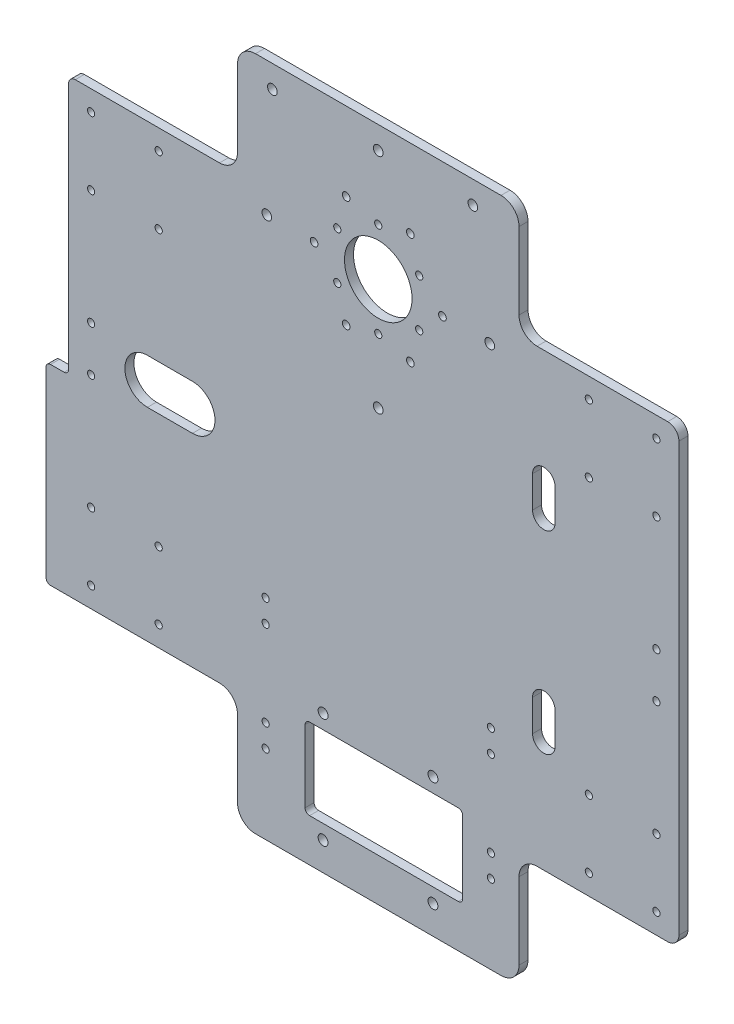
from build123d import *

# Parameters (mm, degrees)
SKETCH_281X300_25_R   = 1.6
SKETCH_281X300_25_R_2 = 15
SKETCH_281X300_25_R_3 = 2.15
SKETCH_281X300_25_R_4 = 2.2
F_4MM_DEPTH           = 4
XRU2012_3_4_57_2_R    = 1.7
XRU2012_3_4_57_DEPTH  = 4


with BuildPart() as part:
    # 底板轮廓_281x300_安装孔外移25 → 凸台拉伸_4mm (new body)
    with BuildSketch(Plane.XY):
        with BuildLine():
            Line((-55.5, 108), (-55.5, 142))
            ThreePointArc((-55.5, 142), (-53.156854249, 147.656854249), (-47.5, 150))
            Line((-47.5, 150), (61.5, 150))
            ThreePointArc((61.5, 150), (67.156854249, 147.656854249), (69.5, 142))
            Line((69.5, 142), (69.5, 108))
            ThreePointArc((69.5, 108), (71.843145751, 102.343145751), (77.5, 100))
            Line((77.5, 100), (135.5, 100))
            ThreePointArc((135.5, 100), (139.035533906, 98.535533906), (140.5, 95))
            Line((140.5, 95), (140.5, -95))
            ThreePointArc((140.5, -95), (139.035533906, -98.535533906), (135.5, -100))
            Line((135.5, -100), (77.5, -100))
            ThreePointArc((77.5, -100), (71.843145751, -102.343145751), (69.5, -108))
            Line((69.5, -108), (69.5, -142))
            ThreePointArc((69.5, -142), (67.156854249, -147.656854249), (61.5, -150))
            Line((61.5, -150), (-47.5, -150))
            ThreePointArc((-47.5, -150), (-53.156854249, -147.656854249), (-55.5, -142))
            Line((-55.5, -142), (-55.5, -108))
            ThreePointArc((-55.5, -108), (-57.843145751, -102.343145751), (-63.5, -100))
            Line((-63.5, -100), (-138.5, -100))
            ThreePointArc((-138.5, -100), (-139.914213562, -99.414213562), (-140.5, -98))
            Line((-140.5, -98), (-140.5, -17))
            ThreePointArc((-140.5, -17), (-139.914213562, -15.585786438), (-138.5, -15))
            Line((-138.5, -15), (-132.5, -15))
            ThreePointArc((-132.5, -15), (-131.085786438, -14.414213562), (-130.5, -13))
            Line((-130.5, -13), (-130.5, 97))
            ThreePointArc((-130.5, 97), (-129.621320344, 99.121320344), (-127.5, 100))
            Line((-127.5, 100), (-63.5, 100))
            ThreePointArc((-63.5, 100), (-57.843145751, 102.343145751), (-55.5, 108))
        make_face()
        with Locations((100.5, -61)):
            Circle(SKETCH_281X300_25_R, mode=Mode.SUBTRACT)
        with Locations((130.5, -61)):
            Circle(SKETCH_281X300_25_R, mode=Mode.SUBTRACT)
        with Locations((100.5, 61)):
            Circle(SKETCH_281X300_25_R, mode=Mode.SUBTRACT)
        with Locations((7, 90.5)):
            Circle(SKETCH_281X300_25_R_2, mode=Mode.SUBTRACT)
        with Locations((7, 140)):
            Circle(SKETCH_281X300_25_R_3, mode=Mode.SUBTRACT)
        with Locations((-42.5, 90.5)):
            Circle(SKETCH_281X300_25_R_3, mode=Mode.SUBTRACT)
        with Locations((56.5, 90.5)):
            Circle(SKETCH_281X300_25_R_3, mode=Mode.SUBTRACT)
        with Locations((-40, 140)):
            Circle(SKETCH_281X300_25_R_3, mode=Mode.SUBTRACT)
        with Locations((130.5, 61)):
            Circle(SKETCH_281X300_25_R, mode=Mode.SUBTRACT)
        with Locations((49, 140)):
            Circle(SKETCH_281X300_25_R_3, mode=Mode.SUBTRACT)
        with Locations((7, 41)):
            Circle(SKETCH_281X300_25_R_3, mode=Mode.SUBTRACT)
        with Locations((31.290367902, -137.395183951)):
            Circle(SKETCH_281X300_25_R_4, mode=Mode.SUBTRACT)
        with Locations((-17.5, -137.395183951)):
            Circle(SKETCH_281X300_25_R_4, mode=Mode.SUBTRACT)
        with Locations((-17.5, -88.604816049)):
            Circle(SKETCH_281X300_25_R_4, mode=Mode.SUBTRACT)
        with Locations((31.290367902, -88.604816049)):
            Circle(SKETCH_281X300_25_R_4, mode=Mode.SUBTRACT)
        with Locations((7, 111.5)):
            Circle(SKETCH_281X300_25_R, mode=Mode.SUBTRACT)
        with Locations((25.186533479, 101)):
            Circle(SKETCH_281X300_25_R, mode=Mode.SUBTRACT)
        with Locations((100.5, -91)):
            Circle(SKETCH_281X300_25_R, mode=Mode.SUBTRACT)
        with Locations((25.186533479, 80)):
            Circle(SKETCH_281X300_25_R, mode=Mode.SUBTRACT)
        with Locations((100.5, 91)):
            Circle(SKETCH_281X300_25_R, mode=Mode.SUBTRACT)
        with Locations((7, 69.5)):
            Circle(SKETCH_281X300_25_R, mode=Mode.SUBTRACT)
        with Locations((130.5, 91)):
            Circle(SKETCH_281X300_25_R, mode=Mode.SUBTRACT)
        with Locations((130.5, -91)):
            Circle(SKETCH_281X300_25_R, mode=Mode.SUBTRACT)
        with Locations((-43, -105)):
            Circle(SKETCH_281X300_25_R, mode=Mode.SUBTRACT)
        with Locations((57, -57)):
            Circle(SKETCH_281X300_25_R, mode=Mode.SUBTRACT)
        with Locations((-43, -57)):
            Circle(SKETCH_281X300_25_R, mode=Mode.SUBTRACT)
        with Locations((57, -105)):
            Circle(SKETCH_281X300_25_R, mode=Mode.SUBTRACT)
        with Locations((-11.186533479, 80)):
            Circle(SKETCH_281X300_25_R, mode=Mode.SUBTRACT)
        with Locations((-11.186533479, 101)):
            Circle(SKETCH_281X300_25_R, mode=Mode.SUBTRACT)
        with Locations((130.5, 10)):
            Circle(SKETCH_281X300_25_R, mode=Mode.SUBTRACT)
        with Locations((130.5, -10)):
            Circle(SKETCH_281X300_25_R, mode=Mode.SUBTRACT)
        with Locations((-120.5, 10)):
            Circle(SKETCH_281X300_25_R, mode=Mode.SUBTRACT)
        with Locations((-120.5, -10)):
            Circle(SKETCH_281X300_25_R, mode=Mode.SUBTRACT)
        with Locations((-43, -115)):
            Circle(SKETCH_281X300_25_R, mode=Mode.SUBTRACT)
        with Locations((57, -67)):
            Circle(SKETCH_281X300_25_R, mode=Mode.SUBTRACT)
        with Locations((57, -115)):
            Circle(SKETCH_281X300_25_R, mode=Mode.SUBTRACT)
        with Locations((-43, -67)):
            Circle(SKETCH_281X300_25_R, mode=Mode.SUBTRACT)
        with Locations((-120.5, -91)):
            Circle(SKETCH_281X300_25_R, mode=Mode.SUBTRACT)
        with Locations((-90.5, -91)):
            Circle(SKETCH_281X300_25_R, mode=Mode.SUBTRACT)
        with Locations((-120.5, 91)):
            Circle(SKETCH_281X300_25_R, mode=Mode.SUBTRACT)
        with Locations((-90.5, 91)):
            Circle(SKETCH_281X300_25_R, mode=Mode.SUBTRACT)
        with Locations((-90.5, 61)):
            Circle(SKETCH_281X300_25_R, mode=Mode.SUBTRACT)
        with Locations((-120.5, 61)):
            Circle(SKETCH_281X300_25_R, mode=Mode.SUBTRACT)
        with Locations((-90.5, -61)):
            Circle(SKETCH_281X300_25_R, mode=Mode.SUBTRACT)
        with Locations((-120.5, -61)):
            Circle(SKETCH_281X300_25_R, mode=Mode.SUBTRACT)
        with BuildLine():
            Line((-25.5, -97), (-25.5, -129))
            ThreePointArc((-25.5, -129), (-24.914213562, -130.414213562), (-23.5, -131))
            Line((-23.5, -131), (42.5, -131))
            ThreePointArc((42.5, -131), (43.914213562, -130.414213562), (44.5, -129))
            Line((44.5, -129), (44.5, -97))
            ThreePointArc((44.5, -97), (43.914213562, -95.585786438), (42.5, -95))
            Line((42.5, -95), (-23.5, -95))
            ThreePointArc((-23.5, -95), (-24.914213562, -95.585786438), (-25.5, -97))
        make_face(mode=Mode.SUBTRACT)
        with BuildLine():
            Line((75.5, 50), (75.5, 36))
            ThreePointArc((75.5, 36), (80.5, 31), (85.5, 36))
            Line((85.5, 36), (85.5, 50))
            ThreePointArc((85.5, 50), (80.5, 55), (75.5, 50))
        make_face(mode=Mode.SUBTRACT)
        with BuildLine():
            Line((85.5, -50), (85.5, -36))
            ThreePointArc((85.5, -36), (80.5, -31), (75.5, -36))
            Line((75.5, -36), (75.5, -50))
            ThreePointArc((75.5, -50), (80.5, -55), (85.5, -50))
        make_face(mode=Mode.SUBTRACT)
        with BuildLine():
            Line((-95.5, -10), (-75.5, -10))
            ThreePointArc((-75.5, -10), (-65.5, 0), (-75.5, 10))
            Line((-75.5, 10), (-95.5, 10))
            ThreePointArc((-95.5, 10), (-105.5, 0), (-95.5, -10))
        make_face(mode=Mode.SUBTRACT)
    extrude(amount=F_4MM_DEPTH)

    # XRU2012__3.4___57 2 → XRU2012__3.4___57 (cut)
    with BuildSketch(Plane.XY.offset(4)):
        with Locations((35.5, 90.5)):
            Circle(XRU2012_3_4_57_2_R)
        with Locations((21.25, 115.181724008)):
            Circle(XRU2012_3_4_57_2_R)
        with Locations((-7.25, 115.181724008)):
            Circle(XRU2012_3_4_57_2_R)
        with Locations((-21.5, 90.5)):
            Circle(XRU2012_3_4_57_2_R)
        with Locations((-7.25, 65.818275992)):
            Circle(XRU2012_3_4_57_2_R)
        with Locations((21.25, 65.818275992)):
            Circle(XRU2012_3_4_57_2_R)
    extrude(amount=-XRU2012_3_4_57_DEPTH, mode=Mode.SUBTRACT)


solid = part.part
